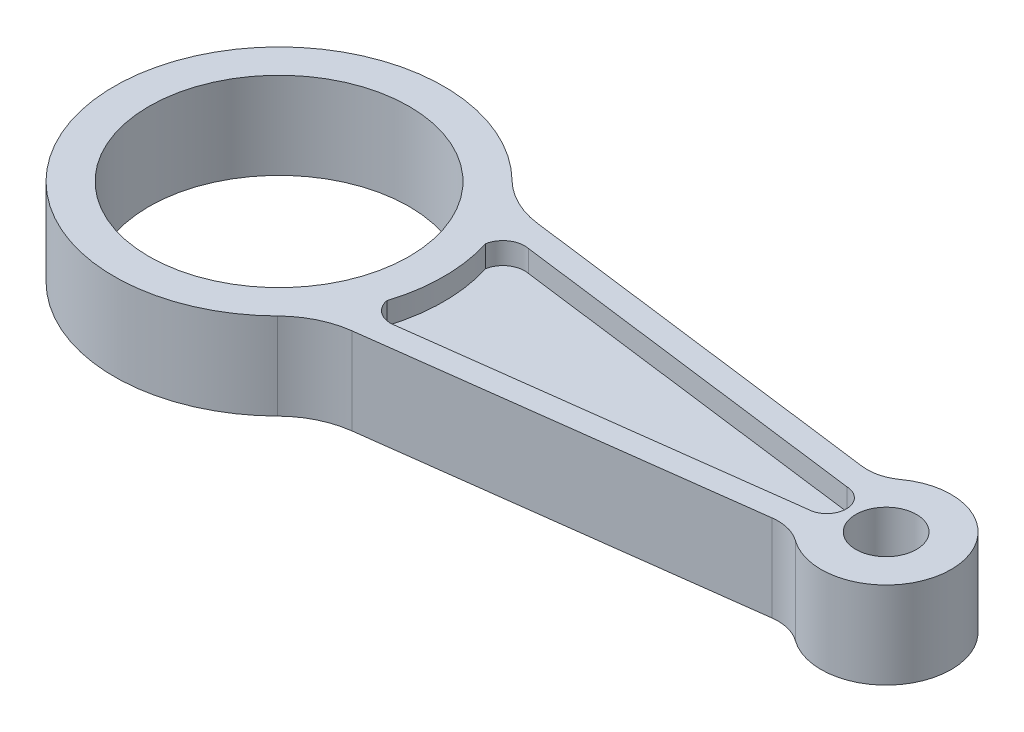
from build123d import *

# Parameters (mm, degrees)
SKETCH1_R           = 30
SKETCH1_R_2         = 7
BOSS_EXTRUDE1_DEPTH = 10
FILLET1_R           = 10
FILLET2_R           = 20
CUT_EXTRUDE1_START  = 10
CUT_EXTRUDE1_DEPTH  = 5


with BuildPart() as part:
    # Sketch1 → Boss-Extrude1 (new, symmetric)
    with BuildSketch(Plane(origin=(0, 0, 0), x_dir=(1, 0, 0), z_dir=(0, 1, 0))):
        with BuildLine():
            Line((30.700703589, 22.393454382), (128.610913115, 9.761593104))
            ThreePointArc((128.610913115, 9.761593104), (155, 0), (128.610913115, -9.761593104))
            Line((128.610913115, -9.761593104), (30.700703589, -22.393454382))
            ThreePointArc((30.700703589, -22.393454382), (-38, 0), (30.700703589, 22.393454382))
        make_face()
        with Locations(Location((0, 0, 0), (0, 0, 270))):
            Circle(SKETCH1_R, mode=Mode.SUBTRACT)
        with Locations(Location((140, 0, 0), (0, 0, 270))):
            Circle(SKETCH1_R_2, mode=Mode.SUBTRACT)
    extrude(amount=BOSS_EXTRUDE1_DEPTH, both=True)

    # Fillet1
    fillet1_edges = [part.edges().sort_by_distance(p)[0] for p in [
        (128.610913115, 0, -9.761593104),
        (128.610913115, 0, 9.761593104),
    ]]
    fillet(fillet1_edges, radius=FILLET1_R)

    # Fillet2
    fillet2_edges = [part.edges().sort_by_distance(p)[0] for p in [
        (30.700703589, 0, -22.393454382),
        (30.700703589, 0, 22.393454382),
    ]]
    fillet(fillet2_edges, radius=FILLET2_R)

    # Sketch2 → Cut-Extrude1 (cut)
    with BuildSketch(Plane(origin=(0, 0, 0), x_dir=(1, 0, 0), z_dir=(0, 1, 0)).offset(CUT_EXTRUDE1_START)):
        with BuildLine():
            Line((42.097828348, -15.377472859), (126.418285087, -4.498890149))
            ThreePointArc((126.418285087, -4.498890149), (130.818347989, 0), (126.418285087, 4.498890149))
            Line((126.418285087, 4.498890149), (42.097828348, 15.377472859))
            ThreePointArc((42.097828348, 15.377472859), (38.350242622, 14.602706981), (36.248141548, 11.404921495))
            ThreePointArc((36.248141548, 11.404921495), (38, 0), (36.248141548, -11.404921495))
            ThreePointArc((36.248141548, -11.404921495), (38.350242622, -14.602706981), (42.097828348, -15.377472859))
        make_face()
    extrude(amount=-CUT_EXTRUDE1_DEPTH, mode=Mode.SUBTRACT)


solid = part.part
